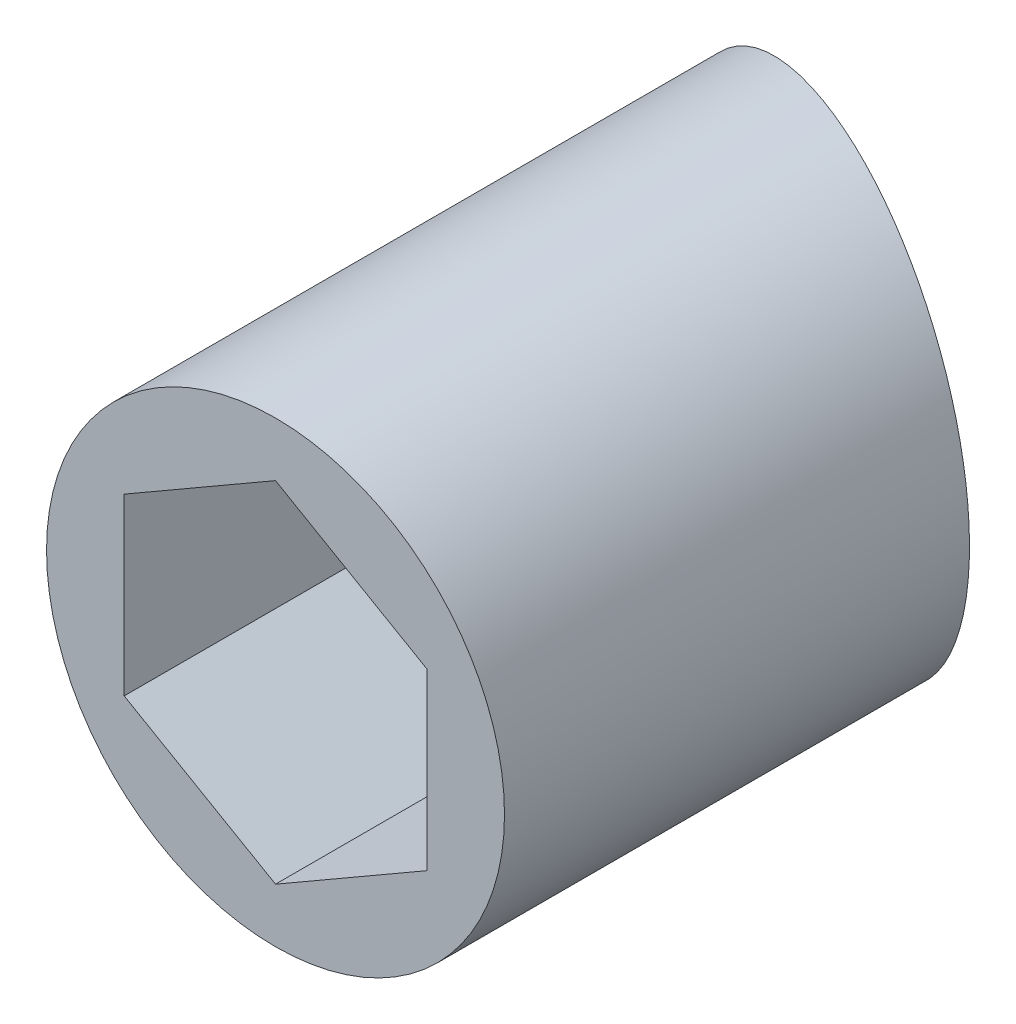
from build123d import *

# Parameters (mm, degrees)
SKETCH_1_R                        = 4.35
EXTRUDE_1_DEPTH                   = 12
CUT_EXTRUDE_480_DEPTH             = 9
CUT_EXTRUDE_727_REACH             = 15.485
CUT_EXTRUDE_727_DIRECTION_2_REACH = 15.485


with BuildPart() as part:
    # Эскиз1 → Бобышка-Вытянуть1 (new body)
    with BuildSketch(Plane.XY):
        Circle(SKETCH_1_R)
    extrude(amount=EXTRUDE_1_DEPTH)

    # Эскиз2 → Cut-Extrude 480 (cut)
    with BuildSketch(Plane.XY.offset(12)):
        Polygon((0, 3.319764048), (-2.875, 1.659882024), (-2.875, -1.659882024), (0, -3.319764048), (2.875, -1.659882024), (2.875, 1.659882024), align=None)
    extrude(amount=-CUT_EXTRUDE_480_DEPTH, mode=Mode.SUBTRACT)

    # Эскиз3 → Cut-Extrude 727 (cut, up to next)
    with BuildSketch(Plane(origin=(0, 0, 0), x_dir=(1, 0, 0), z_dir=(0, 1, 0)), mode=Mode.PRIVATE) as cut_extrude_727_sk1:
        Polygon((-4.35, 0), (4.35, -3.166541038), (4.35, 0), align=None)
    cut_extrude_727_tool1 = extrude(cut_extrude_727_sk1.sketch, amount=-CUT_EXTRUDE_727_REACH, mode=Mode.PRIVATE) & part.part
    add(cut_extrude_727_tool1.solids().sort_by_distance((1.45, 0, 1.055514))[0], mode=Mode.SUBTRACT)

    # Эскиз3 → Cut-Extrude 727 direction 2 (cut, up to next)
    with BuildSketch(Plane(origin=(0, 0, 0), x_dir=(1, 0, 0), z_dir=(0, 1, 0)), mode=Mode.PRIVATE) as cut_extrude_727_direction_2_sk1:
        Polygon((-4.35, 0), (4.35, -3.166541038), (4.35, 0), align=None)
    cut_extrude_727_direction_2_tool1 = extrude(cut_extrude_727_direction_2_sk1.sketch, amount=CUT_EXTRUDE_727_DIRECTION_2_REACH, mode=Mode.PRIVATE) & part.part
    add(cut_extrude_727_direction_2_tool1.solids().sort_by_distance((1.45, 0, 1.055514))[0], mode=Mode.SUBTRACT)


solid = part.part
